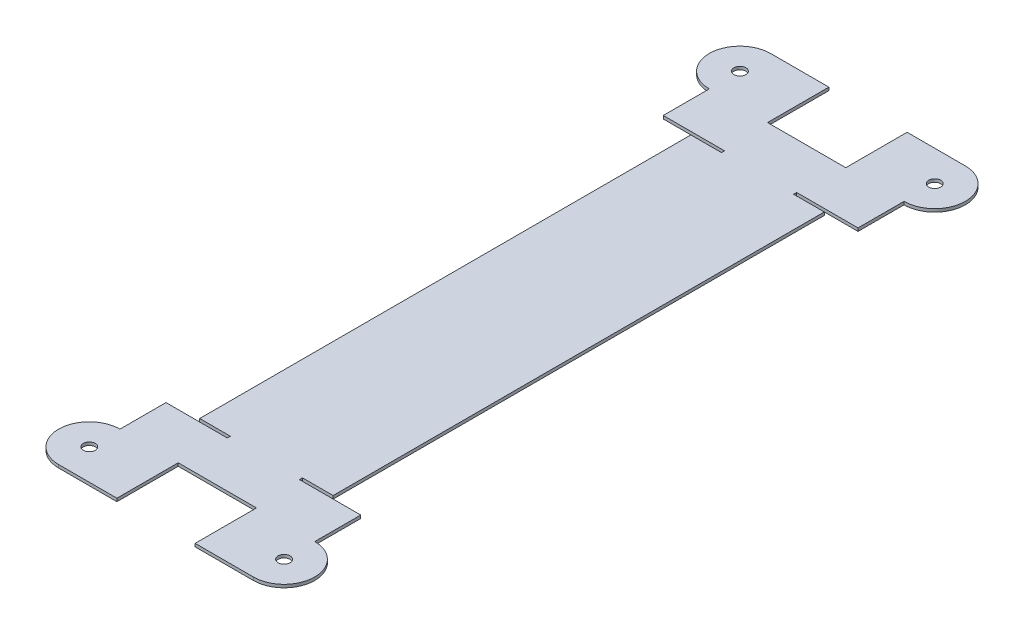
from build123d import *

# Parameters (mm, degrees)
SKETCH1_R           = 1.95
BOSS_EXTRUDE1_DEPTH = 1


with BuildPart() as part:
    # Sketch1 → Boss-Extrude1 (new body)
    with BuildSketch(Plane(origin=(0, 0, 0), x_dir=(1, 0, 0), z_dir=(0, 1, 0))):
        with BuildLine():
            Line((-31.75, 116.06601718), (-12.75, 116.06601718))
            Line((-12.75, 116.06601718), (-12.75, 96.06601718))
            Line((-12.75, 96.06601718), (-11.75, 96.06601718))
            Line((-11.75, 96.06601718), (11.75, 96.06601718))
            Line((11.75, 96.06601718), (12.75, 96.06601718))
            Line((12.75, 96.06601718), (12.75, 116.06601718))
            Line((12.75, 116.06601718), (31.75, 116.06601718))
            ThreePointArc((31.75, 116.06601718), (41.75, 106.06601718), (31.75, 96.06601718))
            Line((31.75, 96.06601718), (31.75, 81.06601718))
            Line((31.75, 81.06601718), (11.75, 81.06601718))
            Line((11.75, 81.06601718), (11.75, 80.06601718))
            Line((11.75, 80.06601718), (21.75, 80.06601718))
            Line((21.75, 80.06601718), (21.75, -80.06601718))
            Line((21.75, -80.06601718), (11.75, -80.06601718))
            Line((11.75, -80.06601718), (11.75, -81.06601718))
            Line((11.75, -81.06601718), (31.75, -81.06601718))
            Line((31.75, -81.06601718), (31.75, -96.06601718))
            ThreePointArc((31.75, -96.06601718), (41.75, -106.06601718), (31.75, -116.06601718))
            Line((31.75, -116.06601718), (12.75, -116.06601718))
            Line((12.75, -116.06601718), (12.75, -96.06601718))
            Line((12.75, -96.06601718), (11.75, -96.06601718))
            Line((11.75, -96.06601718), (-11.75, -96.06601718))
            Line((-11.75, -96.06601718), (-12.75, -96.06601718))
            Line((-12.75, -96.06601718), (-12.75, -116.06601718))
            Line((-12.75, -116.06601718), (-31.75, -116.06601718))
            ThreePointArc((-31.75, -116.06601718), (-41.75, -106.06601718), (-31.75, -96.06601718))
            Line((-31.75, -96.06601718), (-31.75, -81.06601718))
            Line((-31.75, -81.06601718), (-11.75, -81.06601718))
            Line((-11.75, -81.06601718), (-11.75, -80.06601718))
            Line((-11.75, -80.06601718), (-21.75, -80.06601718))
            Line((-21.75, -80.06601718), (-21.75, 80.06601718))
            Line((-21.75, 80.06601718), (-11.75, 80.06601718))
            Line((-11.75, 80.06601718), (-11.75, 81.06601718))
            Line((-11.75, 81.06601718), (-31.75, 81.06601718))
            Line((-31.75, 81.06601718), (-31.75, 96.06601718))
            ThreePointArc((-31.75, 96.06601718), (-41.75, 106.06601718), (-31.75, 116.06601718))
        make_face()
        with Locations(Location((-31.75, 106.06601718, 0), (0, 0, 270))):
            Circle(SKETCH1_R, mode=Mode.SUBTRACT)
        with Locations(Location((31.75, 106.06601718, 0), (0, 0, 90))):
            Circle(SKETCH1_R, mode=Mode.SUBTRACT)
        with Locations(Location((31.75, -106.06601718, 0), (0, 0, 270))):
            Circle(SKETCH1_R, mode=Mode.SUBTRACT)
        with Locations(Location((-31.75, -106.06601718, 0), (0, 0, 90))):
            Circle(SKETCH1_R, mode=Mode.SUBTRACT)
    extrude(amount=BOSS_EXTRUDE1_DEPTH)


solid = part.part
